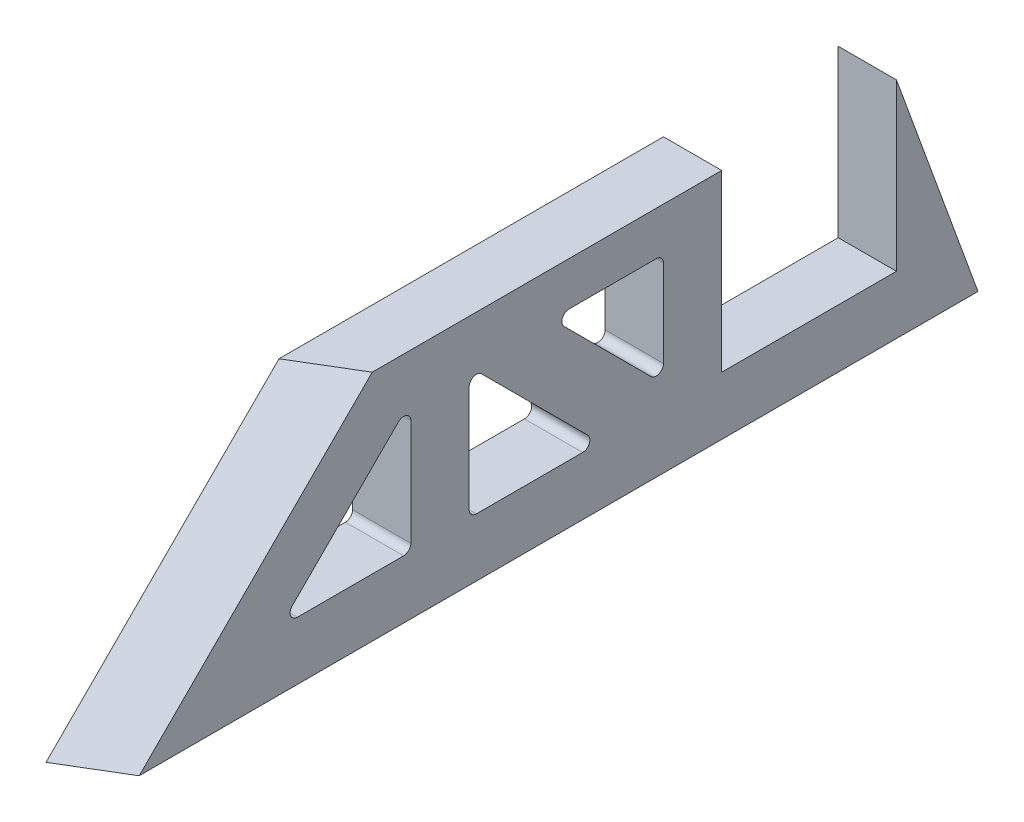
from build123d import *

# Parameters (mm, degrees)
BOSS_EXTRUDE1_DEPTH = 12.7
CUT_EXTRUDE1_DEPTH  = 155.131437711
CUT_EXTRUDE2_REACH  = 110.694
FILLET1_R           = 1.5875


with BuildPart() as part:
    # Sketch1 → Boss-Extrude1 (new body)
    with BuildSketch(Plane(origin=(0, 0, 0), x_dir=(0, 0, -1), z_dir=(1, 0, 0))):
        Polygon((-95.25, 0), (95.25, 0), (77.47, 48.850148518), (77.47, 12.7), (39.37, 12.7), (39.37, 50.8), (-44.45, 50.8), align=None)
    extrude(amount=BOSS_EXTRUDE1_DEPTH)

    # Sketch2 → Cut-Extrude1 (cut, through all, along a direction that is not the sketch's normal)
    with BuildSketch(Plane(origin=(0, 0, 0), x_dir=(-1, 0, 0), z_dir=(0, -1, 0))):
        Polygon((0, -95.25), (-12.7, -95.25), (-12.7, -87.63), align=None)
    extrude(amount=-CUT_EXTRUDE1_DEPTH, dir=(0, -0.7071067811865438, 0.7071067811865512), mode=Mode.SUBTRACT)

    # Sketch4 → Cut-Extrude2 (cut, up to next)
    with BuildSketch(Plane(origin=(12.7, 0, 0), x_dir=(0, 0, -1), z_dir=(1, 0, 0)), mode=Mode.PRIVATE) as cut_extrude2_sk1:
        Polygon((-56.969487758, 12.7), (-28.394487758, 41.275), (-28.394487758, 12.7), align=None)
    cut_extrude2_tool1 = extrude(cut_extrude2_sk1.sketch, amount=-CUT_EXTRUDE2_REACH, mode=Mode.PRIVATE) & part.part
    # Sketch4 → Cut-Extrude2 (cut, up to next)
    with BuildSketch(Plane(origin=(12.7, 0, 0), x_dir=(0, 0, -1), z_dir=(1, 0, 0)), mode=Mode.PRIVATE) as cut_extrude2_sk2:
        Polygon((-15.694487758, 12.7), (-15.694487758, 41.275), (12.880512242, 12.7), align=None)
    cut_extrude2_tool2 = extrude(cut_extrude2_sk2.sketch, amount=-CUT_EXTRUDE2_REACH, mode=Mode.PRIVATE) & part.part
    # Sketch4 → Cut-Extrude2 (cut, up to next)
    with BuildSketch(Plane(origin=(12.7, 0, 0), x_dir=(0, 0, -1), z_dir=(1, 0, 0)), mode=Mode.PRIVATE) as cut_extrude2_sk3:
        Polygon((2.266024484, 41.275), (26.67, 16.871024484), (26.67, 41.275), align=None)
    cut_extrude2_tool3 = extrude(cut_extrude2_sk3.sketch, amount=-CUT_EXTRUDE2_REACH, mode=Mode.PRIVATE) & part.part
    add(cut_extrude2_tool1.solids().sort_by_distance((12.7, 22.225, 37.919488))[0], mode=Mode.SUBTRACT)
    add(cut_extrude2_tool2.solids().sort_by_distance((12.7, 22.225, 6.169488))[0], mode=Mode.SUBTRACT)
    add(cut_extrude2_tool3.solids().sort_by_distance((12.7, 33.140341, -18.535341))[0], mode=Mode.SUBTRACT)

    # Fillet1
    fillet1_edges = [part.edges().sort_by_distance(p)[0] for p in [
        (6.35, 12.7, 28.394487758),
        (6.35, 12.7, 56.969487758),
        (6.35, 41.275, 28.394487758),
        (6.35, 41.275, -2.266024484),
        (6.35, 41.275, -26.67),
        (6.35, 16.871024484, -26.67),
        (6.35, 12.7, -12.880512242),
        (6.35, 12.7, 15.694487758),
        (6.35, 41.275, 15.694487758),
    ]]
    fillet(fillet1_edges, radius=FILLET1_R)


solid = part.part
